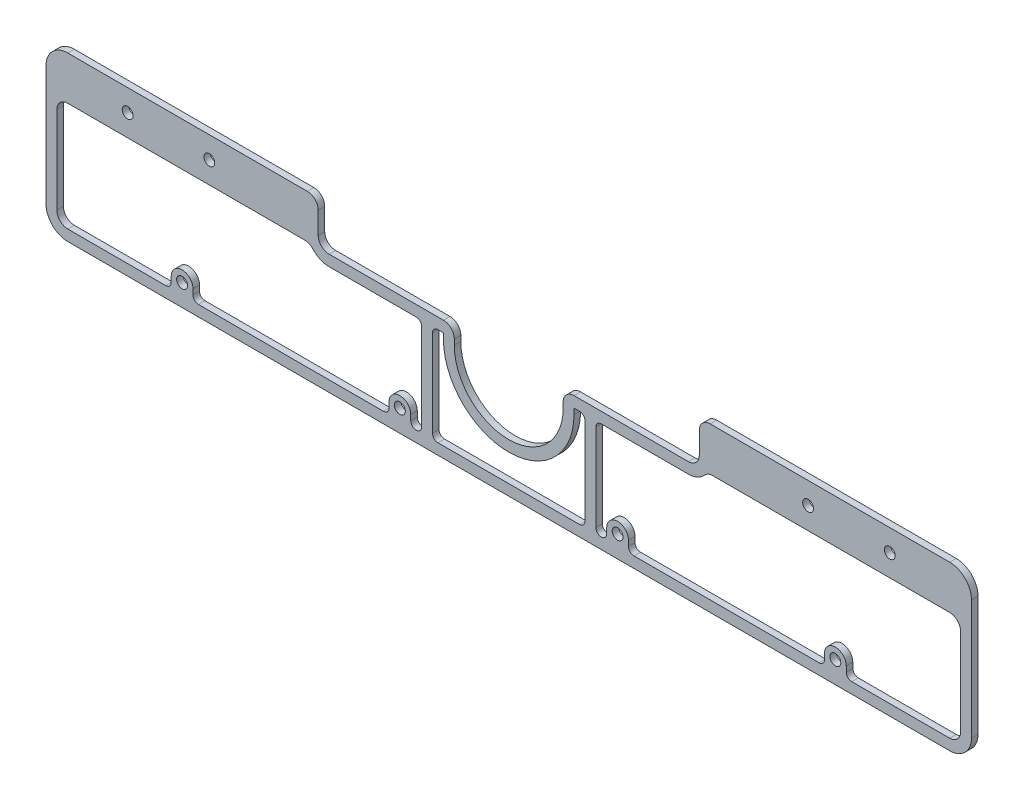
from build123d import *

# Parameters (mm, degrees)
SKETCH1_R           = 5
BOSS_EXTRUDE1_DEPTH = 6
SKETCH2_R           = 5
CUT_EXTRUDE1_DEPTH  = 436.529562716


with BuildPart() as part:
    # Sketch1 → Boss-Extrude1 (new body)
    with BuildSketch(Plane.XY):
        with BuildLine():
            Line((-425, -75), (-425, 35))
            ThreePointArc((-425, 35), (-419.142135624, 49.142135624), (-405, 55))
            Line((-405, 55), (-185.000330481, 55))
            ThreePointArc((-185.000330481, 55), (-177.92926267, 52.071067812), (-175.000330481, 45))
            Line((-175.000330481, 45), (-175.000330481, 25))
            ThreePointArc((-175.000330481, 25), (-172.071398293, 17.928932188), (-165.000330481, 15))
            Line((-165.000330481, 15), (-60, 15))
            ThreePointArc((-60, 15), (-52.928932188, 12.071067812), (-50, 5))
            Line((-50, 5), (-50, 0))
            ThreePointArc((-50, 0), (-35.355339059, -35.355339059), (0, -50))
            Line((0, -50), (0, -95))
            Line((0, -95), (-405, -95))
            ThreePointArc((-405, -95), (-419.142135624, -89.142135624), (-425, -75))
        make_face()
        with Locations((-350, 35)):
            Circle(SKETCH1_R, mode=Mode.SUBTRACT)
        with Locations((-275, 35)):
            Circle(SKETCH1_R, mode=Mode.SUBTRACT)
    boss_extrude1 = extrude(amount=BOSS_EXTRUDE1_DEPTH)

    # Mirror1: Boss-Extrude1 across plane
    add(boss_extrude1.mirror(Plane(origin=(0, -50, 6), x_dir=(0, 0, 1), z_dir=(-1, 0, 0))))

    # Sketch2 → Cut-Extrude1 (cut, through all)
    with BuildSketch(Plane.XY.offset(6)):
        with BuildLine():
            ThreePointArc((-310, -75), (-300, -65), (-290, -75))
            Line((-290, -75), (-290, -80))
            ThreePointArc((-290, -80), (-288.535533906, -83.535533906), (-285, -85))
            Line((-285, -85), (-115, -85))
            ThreePointArc((-115, -85), (-111.464466094, -83.535533906), (-110, -80))
            Line((-110, -80), (-110, -75))
            ThreePointArc((-110, -75), (-100, -65), (-90, -75))
            Line((-90, -75), (-90, -80))
            ThreePointArc((-90, -80), (-85, -85), (-80, -80))
            Line((-80, -80), (-80, 0))
            ThreePointArc((-80, 0), (-81.464466094, 3.535533906), (-85, 5))
            Line((-85, 5), (-165.000330481, 5))
            ThreePointArc((-165.000330481, 5), (-173.165296291, 6.742581416), (-179.907450331, 11.666666667))
            ThreePointArc((-179.907450331, 11.666666667), (-183.278527352, 14.128709292), (-187.361010256, 15))
            Line((-187.361010256, 15), (-405, 15))
            ThreePointArc((-405, 15), (-412.071067812, 12.071067812), (-415, 5))
            Line((-415, 5), (-415, -75))
            ThreePointArc((-415, -75), (-412.071067812, -82.071067812), (-405, -85))
            Line((-405, -85), (-315, -85))
            ThreePointArc((-315, -85), (-311.464466094, -83.535533906), (-310, -80))
            Line((-310, -80), (-310, -75))
        make_face()
        with BuildLine():
            ThreePointArc((-70, -80), (-68.535533906, -83.535533906), (-65, -85))
            Line((-65, -85), (0, -85))
            Line((0, -85), (0, -60))
            ThreePointArc((0, -60), (-42.426406871, -42.426406871), (-60, 0))
            Line((-60, 0), (-60, 5))
            Line((-60, 5), (-65, 5))
            ThreePointArc((-65, 5), (-68.535533906, 3.535533906), (-70, 0))
            Line((-70, 0), (-70, -80))
        make_face()
        with Locations((-300, -75)):
            Circle(SKETCH2_R)
        with Locations((-100, -75)):
            Circle(SKETCH2_R)
    cut_extrude1 = extrude(amount=-CUT_EXTRUDE1_DEPTH, mode=Mode.SUBTRACT)

    # Mirror2: Cut-Extrude1 across plane
    add(cut_extrude1.mirror(Plane(origin=(0, 0, 0), x_dir=(0, 0, 1), z_dir=(1, 0, 0))), mode=Mode.SUBTRACT)


solid = part.part
